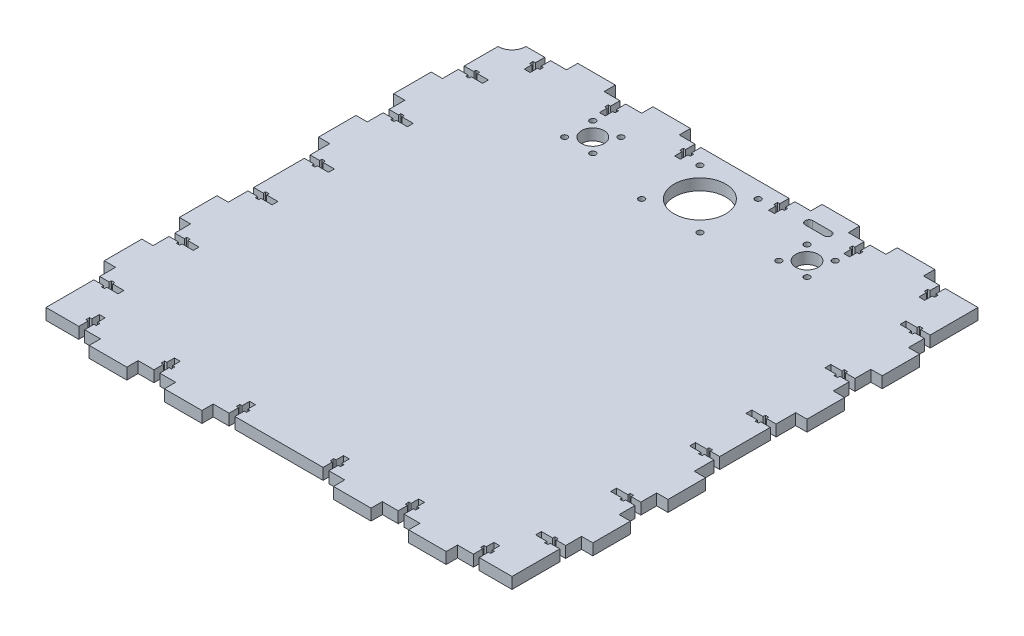
from build123d import *

# Parameters (mm, degrees)
SKETCH1_R           = 1.55
SKETCH1_R_2         = 6
SKETCH1_R_3         = 13.75
BOSS_EXTRUDE1_DEPTH = 6
CUT_EXTRUDE1_DEPTH  = 10
CUT_EXTRUDE2_DEPTH  = 10
SKETCH4_R           = 7.5
CUT_EXTRUDE3_DEPTH  = 10


with BuildPart() as part:
    # Sketch1 → Boss-Extrude1 (new body)
    with BuildSketch(Plane(origin=(0, 0, 0), x_dir=(1, 0, 0), z_dir=(0, 1, 0))):
        Polygon((35, 6), (35, 0), (55, 0), (55, 6), (75, 6), (75, 0), (95, 0), (95, 6), (165, 6), (165, 0), (185, 0), (185, 6), (205, 6), (205, 0), (225, 0), (225, 6), (254, 6), (254, 43), (260, 43), (260, 63), (254, 63), (254, 83), (260, 83), (260, 103), (254, 103), (254, 157), (260, 157), (260, 177), (254, 177), (254, 197), (260, 197), (260, 217), (254, 217), (254, 254), (225, 254), (225, 260), (205, 260), (205, 254), (185, 254), (185, 260), (165, 260), (165, 254), (95, 254), (95, 260), (75, 260), (75, 254), (55, 254), (55, 260), (35, 260), (35, 254), (6, 254), (6, 217), (0, 217), (0, 197), (6, 197), (6, 177), (0, 177), (0, 157), (6, 157), (6, 103), (0, 103), (0, 83), (6, 83), (6, 63), (0, 63), (0, 43), (6, 43), (6, 6), align=None)
        with Locations(Location((194.5, 237.5, 0), (0, 0, 270))):
            Circle(SKETCH1_R, mode=Mode.SUBTRACT)
        with Locations(Location((65.5, 222.5, 0), (0, 0, 270))):
            Circle(SKETCH1_R, mode=Mode.SUBTRACT)
        with Locations(Location((80.5, 222.5, 0), (0, 0, 270))):
            Circle(SKETCH1_R, mode=Mode.SUBTRACT)
        with Locations(Location((114.5, 214.5, 0), (0, 0, 270))):
            Circle(SKETCH1_R, mode=Mode.SUBTRACT)
        with Locations(Location((73, 230, 0), (0, 0, 270))):
            Circle(SKETCH1_R_2, mode=Mode.SUBTRACT)
        with Locations(Location((65.5, 237.5, 0), (0, 0, 270))):
            Circle(SKETCH1_R, mode=Mode.SUBTRACT)
        with Locations(Location((80.5, 237.5, 0), (0, 0, 270))):
            Circle(SKETCH1_R, mode=Mode.SUBTRACT)
        with Locations(Location((114.5, 245.5, 0), (0, 0, 270))):
            Circle(SKETCH1_R, mode=Mode.SUBTRACT)
        with Locations(Location((145.5, 214.5, 0), (0, 0, 270))):
            Circle(SKETCH1_R, mode=Mode.SUBTRACT)
        with Locations(Location((179.5, 222.5, 0), (0, 0, 270))):
            Circle(SKETCH1_R, mode=Mode.SUBTRACT)
        with Locations(Location((194.5, 222.5, 0), (0, 0, 270))):
            Circle(SKETCH1_R, mode=Mode.SUBTRACT)
        with Locations(Location((130, 230, 0), (0, 0, 270))):
            Circle(SKETCH1_R_3, mode=Mode.SUBTRACT)
        with Locations(Location((145.5, 245.5, 0), (0, 0, 270))):
            Circle(SKETCH1_R, mode=Mode.SUBTRACT)
        with Locations(Location((187, 230, 0), (0, 0, 270))):
            Circle(SKETCH1_R_2, mode=Mode.SUBTRACT)
        with Locations(Location((179.5, 237.5, 0), (0, 0, 270))):
            Circle(SKETCH1_R, mode=Mode.SUBTRACT)
    extrude(amount=BOSS_EXTRUDE1_DEPTH)

    # Sketch2 → Cut-Extrude1 (cut)
    with BuildSketch(Plane(origin=(0, 6, 0), x_dir=(1, 0, 0), z_dir=(0, 1, 0))):
        Polygon((23.45, 254), (26.55, 254), (26.55, 249), (27.75, 249), (27.75, 247.1), (26.55, 247.1), (26.55, 243.1), (23.45, 243.1), (23.45, 247.1), (22.25, 247.1), (22.25, 249), (23.45, 249), align=None)
        Polygon((103.45, 254), (106.55, 254), (106.55, 249), (107.75, 249), (107.75, 247.1), (106.55, 247.1), (106.55, 243.1), (103.45, 243.1), (103.45, 247.1), (102.25, 247.1), (102.25, 249), (103.45, 249), align=None)
        Polygon((63.45, 247.1), (63.45, 243.1), (66.55, 243.1), (66.55, 247.1), (67.75, 247.1), (67.75, 249), (66.55, 249), (66.55, 254), (63.45, 254), (63.45, 249), (62.25, 249), (62.25, 247.1), align=None)
        Polygon((153.45, 247.1), (153.45, 243.1), (156.55, 243.1), (156.55, 247.1), (157.75, 247.1), (157.75, 249), (156.55, 249), (156.55, 254), (153.45, 254), (153.45, 249), (152.25, 249), (152.25, 247.1), align=None)
        Polygon((193.45, 254), (196.55, 254), (196.55, 249), (197.75, 249), (197.75, 247.1), (196.55, 247.1), (196.55, 243.1), (193.45, 243.1), (193.45, 247.1), (192.25, 247.1), (192.25, 249), (193.45, 249), align=None)
        Polygon((233.45, 247.1), (233.45, 243.1), (236.55, 243.1), (236.55, 247.1), (237.75, 247.1), (237.75, 249), (236.55, 249), (236.55, 254), (233.45, 254), (233.45, 249), (232.25, 249), (232.25, 247.1), align=None)
        Polygon((236.55, 6), (233.45, 6), (233.45, 11), (232.25, 11), (232.25, 12.9), (233.45, 12.9), (233.45, 16.9), (236.55, 16.9), (236.55, 12.9), (237.75, 12.9), (237.75, 11), (236.55, 11), align=None)
        Polygon((156.55, 6), (153.45, 6), (153.45, 11), (152.25, 11), (152.25, 12.9), (153.45, 12.9), (153.45, 16.9), (156.55, 16.9), (156.55, 12.9), (157.75, 12.9), (157.75, 11), (156.55, 11), align=None)
        Polygon((196.55, 12.9), (196.55, 16.9), (193.45, 16.9), (193.45, 12.9), (192.25, 12.9), (192.25, 11), (193.45, 11), (193.45, 6), (196.55, 6), (196.55, 11), (197.75, 11), (197.75, 12.9), align=None)
        Polygon((106.55, 12.9), (106.55, 16.9), (103.45, 16.9), (103.45, 12.9), (102.25, 12.9), (102.25, 11), (103.45, 11), (103.45, 6), (106.55, 6), (106.55, 11), (107.75, 11), (107.75, 12.9), align=None)
        Polygon((66.55, 6), (63.45, 6), (63.45, 11), (62.25, 11), (62.25, 12.9), (63.45, 12.9), (63.45, 16.9), (66.55, 16.9), (66.55, 12.9), (67.75, 12.9), (67.75, 11), (66.55, 11), align=None)
        Polygon((26.55, 12.9), (26.55, 16.9), (23.45, 16.9), (23.45, 12.9), (22.25, 12.9), (22.25, 11), (23.45, 11), (23.45, 6), (26.55, 6), (26.55, 11), (27.75, 11), (27.75, 12.9), align=None)
    extrude(amount=-CUT_EXTRUDE1_DEPTH, mode=Mode.SUBTRACT)

    # Sketch3 → Cut-Extrude2 (cut)
    with BuildSketch(Plane(origin=(0, 6, 0), x_dir=(1, 0, 0), z_dir=(0, 1, 0))):
        Polygon((6, 228.55), (11.1, 228.55), (11.1, 229.75), (12.9, 229.75), (12.9, 228.55), (18.9, 228.55), (18.9, 225.45), (12.9, 225.45), (12.9, 224.25), (11.1, 224.25), (11.1, 225.45), (6, 225.45), align=None)
        Polygon((12.9, 188.55), (18.9, 188.55), (18.9, 185.45), (12.9, 185.45), (12.9, 184.25), (11.1, 184.25), (11.1, 185.45), (6, 185.45), (6, 188.55), (11.1, 188.55), (11.1, 189.75), (12.9, 189.75), align=None)
        Polygon((6, 146.55), (11.1, 146.55), (11.1, 147.75), (12.9, 147.75), (12.9, 146.55), (18.9, 146.55), (18.9, 143.45), (12.9, 143.45), (12.9, 142.25), (11.1, 142.25), (11.1, 143.45), (6, 143.45), align=None)
        Polygon((12.9, 116.55), (18.9, 116.55), (18.9, 113.45), (12.9, 113.45), (12.9, 112.25), (11.1, 112.25), (11.1, 113.45), (6, 113.45), (6, 116.55), (11.1, 116.55), (11.1, 117.75), (12.9, 117.75), align=None)
        Polygon((6, 74.55), (11.1, 74.55), (11.1, 75.75), (12.9, 75.75), (12.9, 74.55), (18.9, 74.55), (18.9, 71.45), (12.9, 71.45), (12.9, 70.25), (11.1, 70.25), (11.1, 71.45), (6, 71.45), align=None)
        Polygon((12.9, 34.55), (18.9, 34.55), (18.9, 31.45), (12.9, 31.45), (12.9, 30.25), (11.1, 30.25), (11.1, 31.45), (6, 31.45), (6, 34.55), (11.1, 34.55), (11.1, 35.75), (12.9, 35.75), align=None)
        Polygon((254, 31.45), (248.9, 31.45), (248.9, 30.25), (247.1, 30.25), (247.1, 31.45), (241.1, 31.45), (241.1, 34.55), (247.1, 34.55), (247.1, 35.75), (248.9, 35.75), (248.9, 34.55), (254, 34.55), align=None)
        Polygon((247.1, 71.45), (241.1, 71.45), (241.1, 74.55), (247.1, 74.55), (247.1, 75.75), (248.9, 75.75), (248.9, 74.55), (254, 74.55), (254, 71.45), (248.9, 71.45), (248.9, 70.25), (247.1, 70.25), align=None)
        Polygon((254, 113.45), (248.9, 113.45), (248.9, 112.25), (247.1, 112.25), (247.1, 113.45), (241.1, 113.45), (241.1, 116.55), (247.1, 116.55), (247.1, 117.75), (248.9, 117.75), (248.9, 116.55), (254, 116.55), align=None)
        Polygon((247.1, 143.45), (241.1, 143.45), (241.1, 146.55), (247.1, 146.55), (247.1, 147.75), (248.9, 147.75), (248.9, 146.55), (254, 146.55), (254, 143.45), (248.9, 143.45), (248.9, 142.25), (247.1, 142.25), align=None)
        Polygon((254, 185.45), (248.9, 185.45), (248.9, 184.25), (247.1, 184.25), (247.1, 185.45), (241.1, 185.45), (241.1, 188.55), (247.1, 188.55), (247.1, 189.75), (248.9, 189.75), (248.9, 188.55), (254, 188.55), align=None)
        Polygon((247.1, 225.45), (241.1, 225.45), (241.1, 228.55), (247.1, 228.55), (247.1, 229.75), (248.9, 229.75), (248.9, 228.55), (254, 228.55), (254, 225.45), (248.9, 225.45), (248.9, 224.25), (247.1, 224.25), align=None)
    extrude(amount=-CUT_EXTRUDE2_DEPTH, mode=Mode.SUBTRACT)

    # Sketch4 → Cut-Extrude3 (cut)
    with BuildSketch(Plane(origin=(0, 6, 0), x_dir=(1, 0, 0), z_dir=(0, 1, 0))):
        with Locations((6, 254)):
            Circle(SKETCH4_R)
        with BuildLine():
            Line((170, 250.048376553), (180, 250.048376553))
            ThreePointArc((180, 250.048376553), (182, 248.048376553), (180, 246.048376553))
            Line((180, 246.048376553), (170, 246.048376553))
            ThreePointArc((170, 246.048376553), (168, 248.048376553), (170, 250.048376553))
        make_face()
    extrude(amount=-CUT_EXTRUDE3_DEPTH, mode=Mode.SUBTRACT)


solid = part.part
